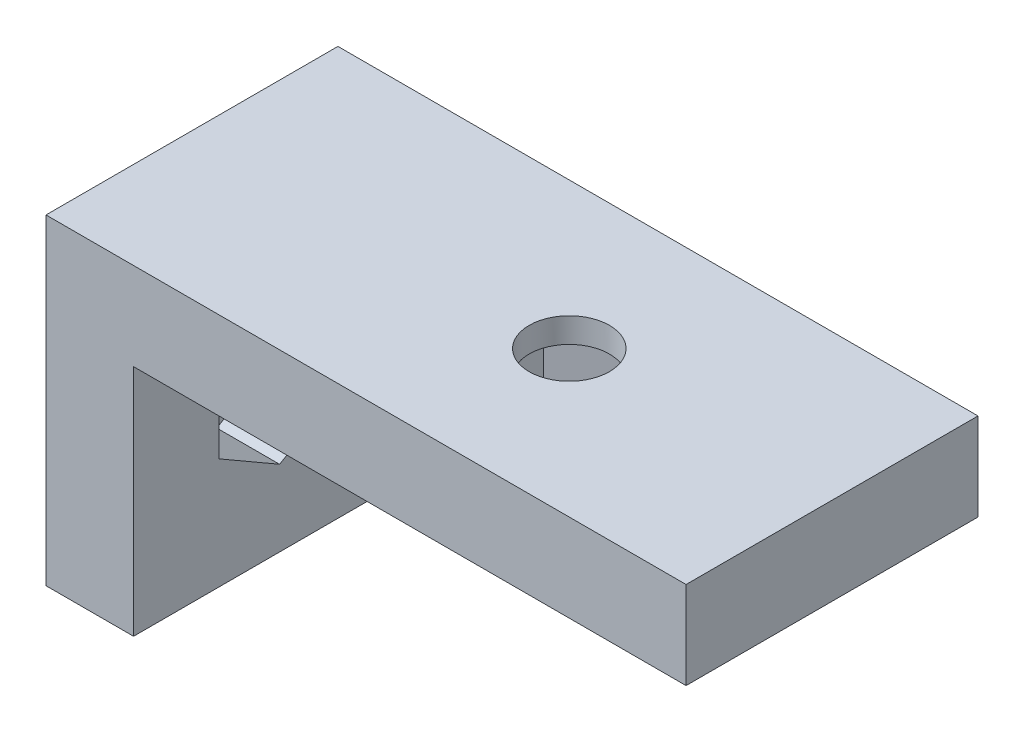
from build123d import *

# Parameters (mm, degrees)
EXTRUDE_20_DEPTH           = 20
CUT_EXTRUDE_5_DEPTH        = 59.172158289
CUT_EXTRUDE_5_DEPTH_BACK   = 59.172158289
SKETCH_5_R                 = 2.75
CUT_EXTRUDE_5_4_3_DEPTH    = 4.3
CUT_EXTRUDE_5_2_DEPTH      = 59.172158289
CUT_EXTRUDE_5_2_DEPTH_BACK = 59.172158289
SKETCH_5_3_R               = 2.75
CUT_EXTRUDE_5_4_3_2_DEPTH  = 4.3


with BuildPart() as part:
    # Профиль_скобы_6мм → Печатный_корпус_20мм (new body)
    with BuildSketch(Plane.XY):
        Polygon((6.15, -22), (12.15, -22), (12.15, -6), (50, -6), (50, 0), (6.15, 0), align=None)
    extrude(amount=EXTRUDE_20_DEPTH)

    # Sketch 5 → Cut-Extrude 5 (cut, two sides: drawn at the far end of the back side and taken through both)
    with BuildSketch(Plane(origin=(0, 0, 0), x_dir=(1, 0, 0), z_dir=(0, 1, 0)).offset(-CUT_EXTRUDE_5_DEPTH_BACK)):
        with Locations(Location((32, -10, 0), (0, 0, 270))):
            Circle(SKETCH_5_R)
    extrude(amount=CUT_EXTRUDE_5_DEPTH + CUT_EXTRUDE_5_DEPTH_BACK, mode=Mode.SUBTRACT)

    # Sketch 5 2 → Cut-Extrude 5_4_3 (cut)
    with BuildSketch(Plane.XZ.offset(6)):
        Polygon((32, 14.792007234), (36.15, 12.396003617), (36.15, 7.603996383), (32, 5.207992766), (27.85, 7.603996383), (27.85, 12.396003617), align=None)
    extrude(amount=-CUT_EXTRUDE_5_4_3_DEPTH, mode=Mode.SUBTRACT)

    # Sketch 5 3 → Cut-Extrude 5 2 (cut, two sides: drawn at the far end of the back side and taken through both)
    with BuildSketch(Plane(origin=(0, 0, 0), x_dir=(0, 0, -1), z_dir=(1, 0, 0)).offset(-CUT_EXTRUDE_5_2_DEPTH_BACK)):
        with Locations(Location((-10, -12, 0), (0, 0, 180))):
            Circle(SKETCH_5_3_R)
    extrude(amount=CUT_EXTRUDE_5_2_DEPTH + CUT_EXTRUDE_5_2_DEPTH_BACK, mode=Mode.SUBTRACT)

    # Sketch 5 4 → Cut-Extrude 5_4_3 2 (cut)
    with BuildSketch(Plane(origin=(12.15, 0, 0), x_dir=(0, 0, -1), z_dir=(1, 0, 0))):
        Polygon((-10, -7.207992766), (-14.15, -9.603996383), (-14.15, -14.396003617), (-10, -16.792007234), (-5.85, -14.396003617), (-5.85, -9.603996383), align=None)
    extrude(amount=-CUT_EXTRUDE_5_4_3_2_DEPTH, mode=Mode.SUBTRACT)


solid = part.part
